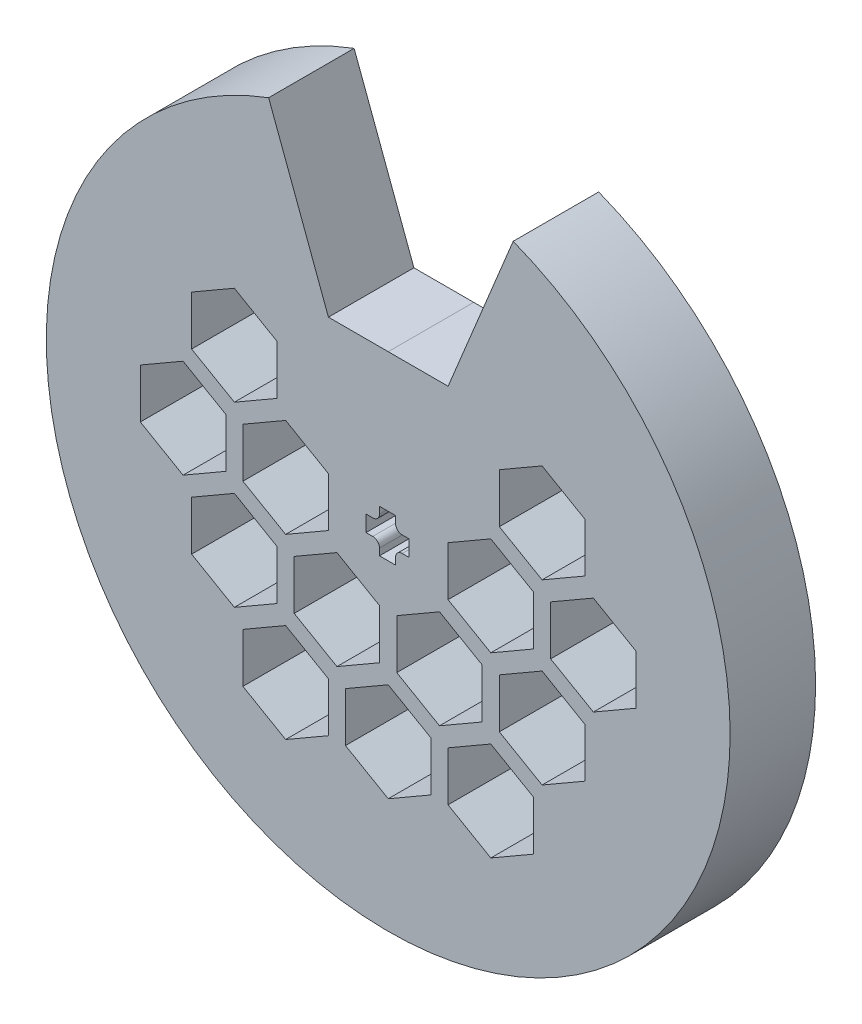
from build123d import *

# Parameters (mm, degrees)
SKETCH1_R                = 40
BOSS_EXTRUDE1_DEPTH      = 10
CUT_EXTRUDE8_DEPTH       = 99
CUT_EXTRUDE9_DEPTH       = 58.445626465
CUT_EXTRUDE9_DEPTH_BACK  = 58.445626465
CUT_EXTRUDE10_DEPTH      = 23
CUT_EXTRUDE10_DEPTH_BACK = 58.445626465


with BuildPart() as part:
    # Sketch1 → Boss-Extrude1 (new body)
    with BuildSketch(Plane.XY):
        Circle(SKETCH1_R)
    extrude(amount=BOSS_EXTRUDE1_DEPTH)

    # Sketch1<10> → Cut-Extrude8 (cut)
    with BuildSketch(Plane.XY):
        Polygon((17, 2.886751346), (12, 5.773502692), (7, 2.886751346), (7, -2.886751346), (12, -5.773502692), (17, -2.886751346), align=None)
        Polygon((29, 2.886751346), (24, 5.773502692), (19, 2.886751346), (19, -2.886751346), (24, -5.773502692), (29, -2.886751346), align=None)
        Polygon((-7, 2.886751346), (-12, 5.773502692), (-17, 2.886751346), (-17, -2.886751346), (-12, -5.773502692), (-7, -2.886751346), align=None)
        Polygon((-19, 2.886751346), (-24, 5.773502692), (-29, 2.886751346), (-29, -2.886751346), (-24, -5.773502692), (-19, -2.886751346), align=None)
        Polygon((-13, 13.279056191), (-18, 16.165807537), (-23, 13.279056191), (-23, 7.505553499), (-18, 4.618802154), (-13, 7.505553499), align=None)
        Polygon((23, 7.505553499), (23, 13.279056191), (18, 16.165807537), (13, 13.279056191), (13, 7.505553499), (18, 4.618802154), align=None)
        Polygon((-13, -13.279056191), (-13, -7.505553499), (-18, -4.618802154), (-23, -7.505553499), (-23, -13.279056191), (-18, -16.165807537), align=None)
        Polygon((-11, -13.279056191), (-6, -16.165807537), (-1, -13.279056191), (-1, -7.505553499), (-6, -4.618802154), (-11, -7.505553499), align=None)
        Polygon((6, -16.165807537), (11, -13.279056191), (11, -7.505553499), (6, -4.618802154), (1, -7.505553499), (1, -13.279056191), align=None)
        Polygon((13, -7.505553499), (13, -13.279056191), (18, -16.165807537), (23, -13.279056191), (23, -7.505553499), (18, -4.618802154), align=None)
        Polygon((-17, -23.671361037), (-12, -26.558112383), (-7, -23.671361037), (-7, -17.897858345), (-12, -15.011106999), (-17, -17.897858345), align=None)
        Polygon((0, -26.558112383), (5, -23.671361037), (5, -17.897858345), (0, -15.011106999), (-5, -17.897858345), (-5, -23.671361037), align=None)
        Polygon((7, -17.897858345), (7, -23.671361037), (12, -26.558112383), (17, -23.671361037), (17, -17.897858345), (12, -15.011106999), align=None)
    extrude(amount=CUT_EXTRUDE8_DEPTH, mode=Mode.SUBTRACT)

    # Sketch1<11> → Cut-Extrude9 (cut, two sides: drawn at the far end of the back side and taken through both)
    with BuildSketch(Plane.XY.offset(-CUT_EXTRUDE9_DEPTH_BACK)):
        with BuildLine():
            Line((-6.994087027, 18.73720221), (0, 18.73720221))
            Line((0, 18.73720221), (7.005912973, 18.73720221))
            Line((7.005912973, 18.73720221), (14.620716001, 37.232172427))
            ThreePointArc((14.620716001, 37.232172427), (0.338668589, 39.998566269), (-13.988174054, 37.47440442))
            Line((-13.988174054, 37.47440442), (-6.994087027, 18.73720221))
        make_face()
    extrude(amount=CUT_EXTRUDE9_DEPTH + CUT_EXTRUDE9_DEPTH_BACK, mode=Mode.SUBTRACT)

    # Sketch1<13> → Cut-Extrude10 (cut, two sides: drawn at the far end of the back side and taken through both)
    with BuildSketch(Plane.XY.offset(-CUT_EXTRUDE10_DEPTH_BACK)):
        with BuildLine():
            Line((0.853688676, -2.457553929), (-1.020561324, -2.457553929))
            Line((-1.020561324, -2.457553929), (-1.020561324, -1.672692112))
            ThreePointArc((-1.020561324, -1.672692112), (-1.25214669, -1.114915123), (-1.810695088, -0.885196516))
            Line((-1.810695088, -0.885196516), (-2.590311324, -0.887803929))
            Line((-2.590311324, -0.887803929), (-2.590311324, 0.991696071))
            Line((-2.590311324, 0.991696071), (-1.802811324, 0.991696071))
            ThreePointArc((-1.802811324, 0.991696071), (-1.245964734, 1.222349481), (-1.015311324, 1.779196071))
            Line((-1.015311324, 1.779196071), (-1.015311324, 2.561446071))
            Line((-1.015311324, 2.561446071), (0.858938676, 2.561446071))
            Line((0.858938676, 2.561446071), (0.858938676, 1.776584255))
            ThreePointArc((0.858938676, 1.776584255), (1.090524042, 1.218807266), (1.649072441, 0.989088659))
            Line((1.649072441, 0.989088659), (2.428688676, 0.991696071))
            Line((2.428688676, 0.991696071), (2.428688676, -0.887803929))
            Line((2.428688676, -0.887803929), (1.641188676, -0.887803929))
            ThreePointArc((1.641188676, -0.887803929), (1.084342086, -1.118457338), (0.853688676, -1.675303929))
            Line((0.853688676, -1.675303929), (0.853688676, -2.457553929))
        make_face()
    extrude(amount=CUT_EXTRUDE10_DEPTH + CUT_EXTRUDE10_DEPTH_BACK, mode=Mode.SUBTRACT)


solid = part.part
